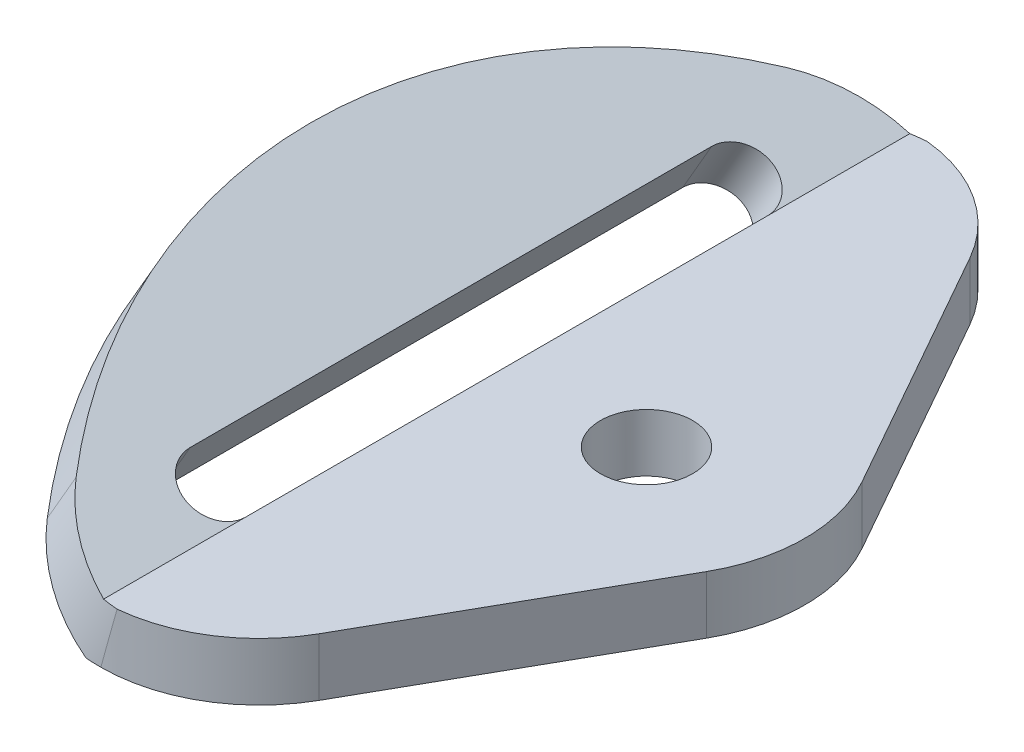
from build123d import *

# Parameters (mm, degrees)
BOSS_EXTRUDE1_DEPTH = 35.179
CUT_EXTRUDE2_START  = -5.0038
SKETCH2_R           = 4
CUT_EXTRUDE2_DEPTH  = 5.0038
CUT_EXTRUDE3_START  = -5.674182
CUT_EXTRUDE3_DEPTH  = 5.674182


with BuildPart() as part:
    # Sketch1 → Boss-Extrude1 (new, symmetric)
    with BuildSketch(Plane.XY):
        Polygon((0, 0), (27.178, 0), (27.178, 5.0038), (1.340764169, 5.0038), (-15.645662336, 14.810917915), (-18.147562336, 10.4775), align=None)
    extrude(amount=BOSS_EXTRUDE1_DEPTH, both=True)

    # Sketch2 → Cut-Extrude2 (cut)
    with BuildSketch(Plane.XZ.offset(CUT_EXTRUDE2_START)):
        with Locations(Location((13.462, 0, 0), (0, 0, 270))):
            Circle(SKETCH2_R)
        with BuildLine():
            Line((1.340764169, 35.179), (53.015235831, 35.179))
            Line((53.015235831, 35.179), (53.015235831, -35.179))
            Line((53.015235831, -35.179), (1.340764169, -35.179))
            ThreePointArc((1.340764169, -35.179), (8.255118058, -33.308689777), (13.28379292, -28.207829149))
            Line((13.28379292, -28.207829149), (25.405028751, -6.744829149))
            ThreePointArc((25.405028751, -6.744829149), (27.178, 0), (25.405028751, 6.744829149))
            Line((25.405028751, 6.744829149), (13.28379292, 28.207829149))
            ThreePointArc((13.28379292, 28.207829149), (8.255118058, 33.308689777), (1.340764169, 35.179))
        make_face()
    extrude(amount=CUT_EXTRUDE2_DEPTH, mode=Mode.SUBTRACT)

    # Sketch3 → Cut-Extrude3 (cut)
    with BuildSketch(Plane(origin=(0, 0, 0), x_dir=(0, 0, 1), z_dir=(-0.4999999999999947, -0.8660254037844417, 0)).offset(CUT_EXTRUDE3_START)):
        with BuildLine():
            Line((22.606, 6.928764169), (-22.606, 6.928764169))
            ThreePointArc((-22.606, 6.928764169), (-25.4, 4.134764169), (-22.606, 1.340764169))
            Line((-22.606, 1.340764169), (22.606, 1.340764169))
            ThreePointArc((22.606, 1.340764169), (25.4, 4.134764169), (22.606, 6.928764169))
        make_face()
        with BuildLine():
            Line((-35.179, -1.161135831), (-35.179, 43.071135831))
            Line((-35.179, 43.071135831), (35.179, 43.071135831))
            Line((35.179, 43.071135831), (35.179, -1.161135831))
            ThreePointArc((35.179, -1.161135831), (34.029362855, 4.335697857), (30.773170225, 8.911072784))
            ThreePointArc((30.773170225, 8.911072784), (0, 20.955), (-30.773170225, 8.911072784))
            ThreePointArc((-30.773170225, 8.911072784), (-34.029362855, 4.335697857), (-35.179, -1.161135831))
        make_face()
    extrude(amount=CUT_EXTRUDE3_DEPTH, mode=Mode.SUBTRACT)


solid = part.part
